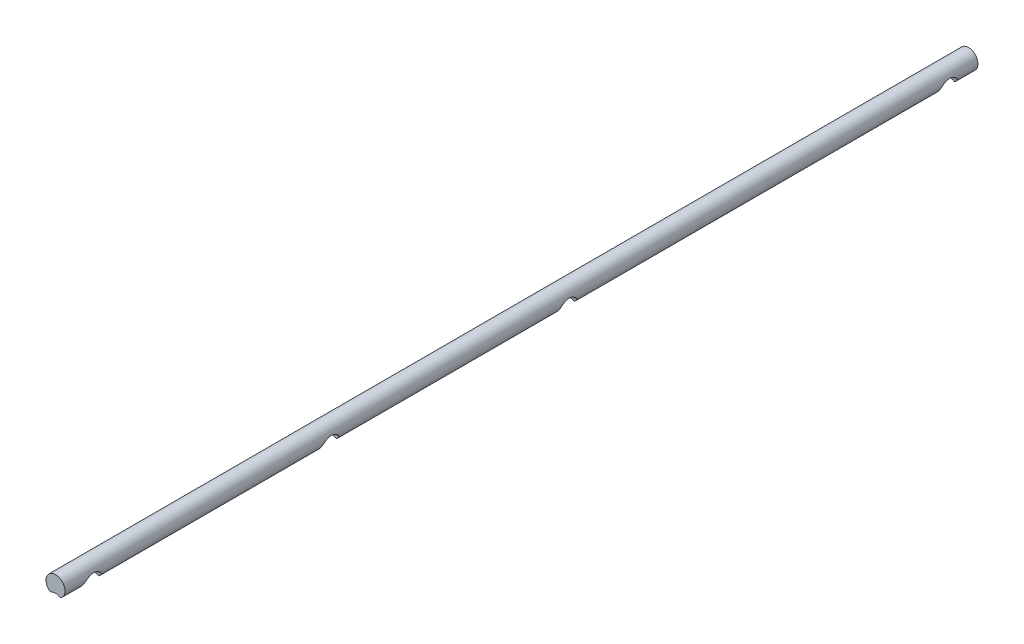
from build123d import *

# Parameters (mm, degrees)
EXTRUDE_1_DEPTH     = 4800
SKETCH_2_R          = 100
CUT_EXTRUDE_1_DEPTH = 3000


with BuildPart() as part:
    # Эскиз1 → Бобышка-Вытянуть1 (new, symmetric)
    with BuildSketch(Plane.XY):
        with BuildLine():
            ThreePointArc((100, 0), (70.710678119, 70.710678119), (0, 100))
            Line((0, 100), (0, -70))
            ThreePointArc((0, -70), (27.658633372, -73.708341903), (53.363596856, -84.571428571))
            ThreePointArc((53.363596856, -84.571428571), (87.568143995, -48.288923753), (100, 0))
        make_face()
        with BuildLine():
            Line((0, -70), (0, 100))
            ThreePointArc((0, 100), (-96.065453877, 27.774602993), (-53.363596856, -84.571428571))
            ThreePointArc((-53.363596856, -84.571428571), (-27.658633372, -73.708341903), (0, -70))
        make_face()
        with BuildLine():
            ThreePointArc((100, 0), (70.710678119, 70.710678119), (0, 100))
            Line((0, 100), (0, -70))
            ThreePointArc((0, -70), (27.658633372, -73.708341903), (53.363596856, -84.571428571))
            ThreePointArc((53.363596856, -84.571428571), (87.568143995, -48.288923753), (100, 0))
        make_face()
        with BuildLine():
            Line((0, -70), (0, 100))
            ThreePointArc((0, 100), (-96.065453877, 27.774602993), (-53.363596856, -84.571428571))
            ThreePointArc((-53.363596856, -84.571428571), (-27.658633372, -73.708341903), (0, -70))
        make_face()
    extrude(amount=EXTRUDE_1_DEPTH, both=True)

    # Эскиз2 → Вырез-Вытянуть1 (cut, symmetric)
    with BuildSketch(Plane(origin=(0, 0, 0), x_dir=(0, 0, -1), z_dir=(1, 0, 0))):
        with Locations((-4500, -84.571428571)):
            Circle(SKETCH_2_R)
        with Locations((4500, -84.571428571)):
            Circle(SKETCH_2_R)
        with Locations((-2000, -84.571428571)):
            Circle(SKETCH_2_R)
        with Locations((500, -84.571428571)):
            Circle(SKETCH_2_R)
    extrude(amount=CUT_EXTRUDE_1_DEPTH, both=True, mode=Mode.SUBTRACT)


solid = part.part
